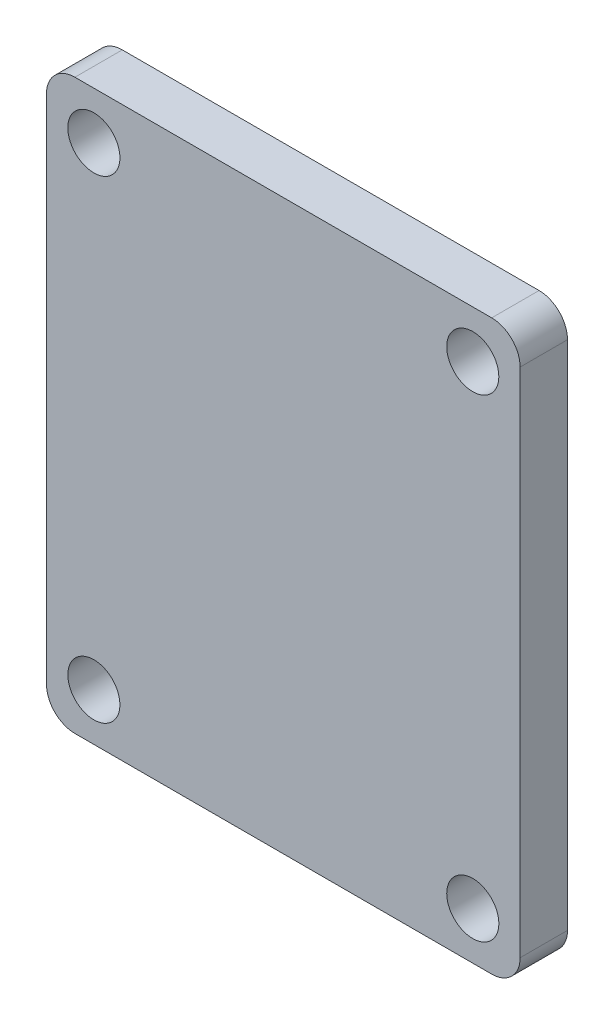
from build123d import *

# Parameters (mm, degrees)
SKETCH2_R           = 2.75
BOSS_EXTRUDE1_DEPTH = 5


with BuildPart() as part:
    # Sketch2 → Boss-Extrude1 (new body)
    with BuildSketch(Plane.XY):
        with BuildLine():
            Line((0, -3), (0, -57))
            ThreePointArc((0, -57), (0.878679656, -59.121320344), (3, -60))
            Line((3, -60), (47, -60))
            ThreePointArc((47, -60), (49.121320344, -59.121320344), (50, -57))
            Line((50, -57), (50, -3))
            ThreePointArc((50, -3), (49.121320344, -0.878679656), (47, 0))
            Line((47, 0), (3, 0))
            ThreePointArc((3, 0), (0.878679656, -0.878679656), (0, -3))
        make_face()
        with Locations((5, -5)):
            Circle(SKETCH2_R, mode=Mode.SUBTRACT)
        with Locations((45, -5)):
            Circle(SKETCH2_R, mode=Mode.SUBTRACT)
        with Locations(Location((45, -55, 0), (0, 0, 180))):
            Circle(SKETCH2_R, mode=Mode.SUBTRACT)
        with Locations(Location((5, -55, 0), (0, 0, 180))):
            Circle(SKETCH2_R, mode=Mode.SUBTRACT)
    extrude(amount=BOSS_EXTRUDE1_DEPTH)


solid = part.part
